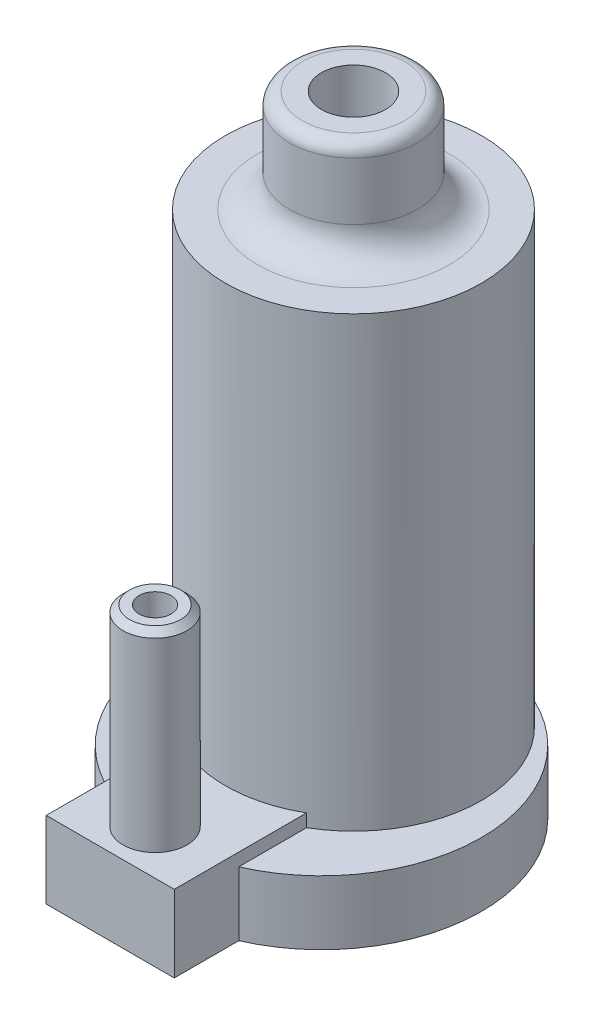
from build123d import *

# Parameters (mm, degrees)
SKETCH_1_R          = 20
EXTRUDE_1_DEPTH     = 80
SKETCH_2_R          = 10
EXTRUDE_2_DEPTH     = 16
SKETCH_3_R          = 25
EXTRUDE_3_DEPTH     = 10
SKETCH_4_W          = 20
SKETCH_4_H          = 38
EXTRUDE_4_DEPTH     = 12
SKETCH_5_R          = 5
EXTRUDE_5_DEPTH     = 30
FILLET_1_R          = 5
FILLET_2_R          = 2
SKETCH_6_R          = 5
CUT_EXTRUDE_1_DEPTH = 30
SKETCH_7_R          = 2.5
CUT_EXTRUDE_2_DEPTH = 30
CHAMFER_1_SIZE      = 1


with BuildPart() as part:
    # Эскиз1 → Бобышка-Вытянуть1 (new body)
    with BuildSketch(Plane(origin=(0, 0, 0), x_dir=(1, 0, 0), z_dir=(0, 1, 0))):
        with Locations(Location((0, 0, 0), (0, 0, 270))):
            Circle(SKETCH_1_R)
    extrude(amount=EXTRUDE_1_DEPTH)

    # Эскиз2 → Бобышка-Вытянуть2 (add)
    with BuildSketch(Plane(origin=(0, 80, 0), x_dir=(1, 0, 0), z_dir=(0, 1, 0))):
        with Locations(Location((0, 0, 0), (0, 0, 270))):
            Circle(SKETCH_2_R)
    extrude(amount=EXTRUDE_2_DEPTH)

    # Эскиз3 → Бобышка-Вытянуть3 (add)
    with BuildSketch(Plane.XZ):
        with Locations(Location((0, 5, 0), (0, 0, 270))):
            Circle(SKETCH_3_R)
    extrude(amount=-EXTRUDE_3_DEPTH)

    # Эскиз4 → Бобышка-Вытянуть4 (add)
    with BuildSketch(Plane.XZ):
        with Locations((0, 19)):
            Rectangle(SKETCH_4_W, SKETCH_4_H)
    extrude(amount=-EXTRUDE_4_DEPTH)

    # Эскиз5 → Бобышка-Вытянуть5 (add)
    with BuildSketch(Plane(origin=(0, 12, 0), x_dir=(1, 0, 0), z_dir=(0, 1, 0))):
        with Locations(Location((0, -31, 0), (0, 0, 90))):
            Circle(SKETCH_5_R)
    extrude(amount=EXTRUDE_5_DEPTH)

    # Скругление1
    fillet_1_edges = [part.edges().sort_by_distance(p)[0] for p in [
        (0, 80, -10),
    ]]
    fillet(fillet_1_edges, radius=FILLET_1_R)

    # Скругление2
    fillet_2_edges = [part.edges().sort_by_distance(p)[0] for p in [
        (0, 96, -10),
    ]]
    fillet(fillet_2_edges, radius=FILLET_2_R)

    # Эскиз6 → Вырез-Вытянуть1 (cut)
    with BuildSketch(Plane(origin=(0, 96, 0), x_dir=(1, 0, 0), z_dir=(0, 1, 0))):
        with Locations(Location((0, 0, 0), (0, 0, 270))):
            Circle(SKETCH_6_R)
    extrude(amount=-CUT_EXTRUDE_1_DEPTH, mode=Mode.SUBTRACT)

    # Эскиз7 → Вырез-Вытянуть2 (cut)
    with BuildSketch(Plane(origin=(0, 42, 0), x_dir=(1, 0, 0), z_dir=(0, 1, 0))):
        with Locations(Location((0, -31, 0), (0, 0, 270))):
            Circle(SKETCH_7_R)
    extrude(amount=-CUT_EXTRUDE_2_DEPTH, mode=Mode.SUBTRACT)

    # Фаска1
    chamfer_1_edges = [part.edges().sort_by_distance(p)[0] for p in [
        (0, 42, 36),
    ]]
    chamfer(chamfer_1_edges, length=CHAMFER_1_SIZE)


solid = part.part
